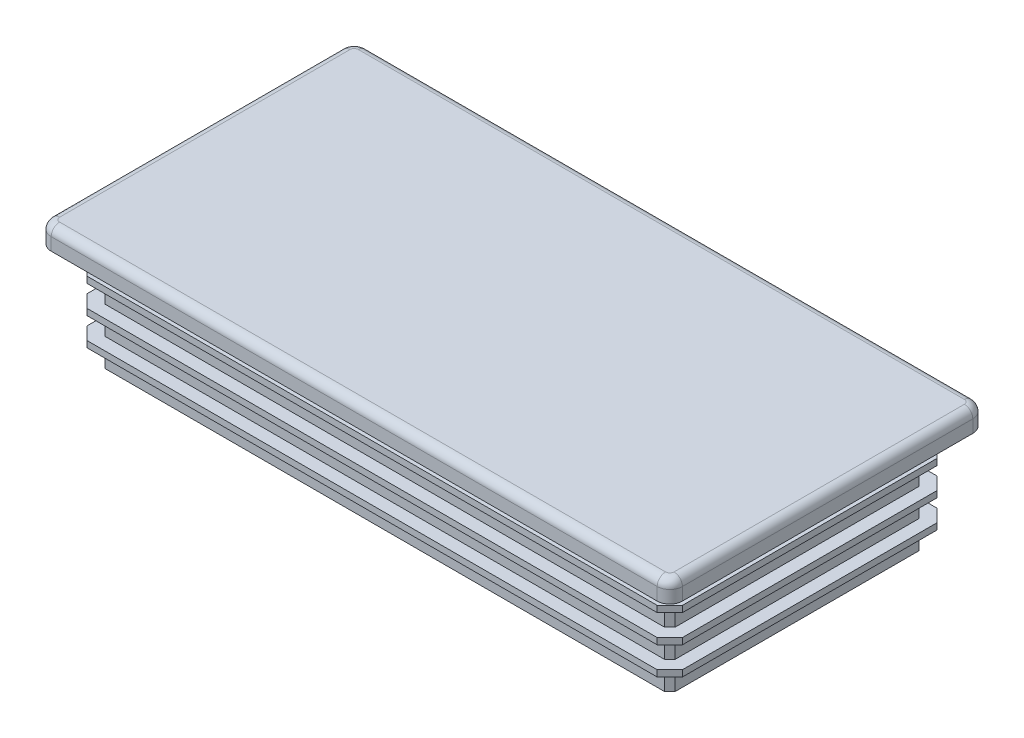
from build123d import *

# Parameters (mm, degrees)
SKETCH1_W           = 71.882
SKETCH1_H           = 33.782
BOSS_EXTRUDE1_DEPTH = 12.7
BOSS_EXTRUDE2_DEPTH = 2.54
CHAMFER1_SIZE       = 1.524
SHELL1_T            = -2.54
SKETCH4_W           = 1.524
SKETCH4_H           = 2.6035
FILLET2_R           = 1.016


with BuildPart() as part:
    # Sketch1 → Boss-Extrude1 (new body)
    with BuildSketch(Plane(origin=(0, 0, 0), x_dir=(1, 0, 0), z_dir=(0, 1, 0))):
        Rectangle(SKETCH1_W, SKETCH1_H)
    extrude(amount=BOSS_EXTRUDE1_DEPTH)

    # Sketch2 → Boss-Extrude2 (add)
    with BuildSketch(Plane(origin=(0, 12.7, 0), x_dir=(1, 0, 0), z_dir=(0, 1, 0))):
        with BuildLine():
            Line((-38.1, 17.526), (-38.1, -17.526))
            ThreePointArc((-38.1, -17.526), (-37.653630735, -18.603630735), (-36.576, -19.05))
            Line((-36.576, -19.05), (36.576, -19.05))
            ThreePointArc((36.576, -19.05), (37.653630735, -18.603630735), (38.1, -17.526))
            Line((38.1, -17.526), (38.1, 17.526))
            ThreePointArc((38.1, 17.526), (37.653630735, 18.603630735), (36.576, 19.05))
            Line((36.576, 19.05), (-36.576, 19.05))
            ThreePointArc((-36.576, 19.05), (-37.653630735, 18.603630735), (-38.1, 17.526))
        make_face()
    extrude(amount=BOSS_EXTRUDE2_DEPTH)

    # Chamfer1
    chamfer1_edges = [part.edges().sort_by_distance(p)[0] for p in [
        (35.941, 6.35, 16.891),
        (-35.941, 6.35, 16.891),
        (-35.941, 6.35, -16.891),
        (35.941, 6.35, -16.891),
    ]]
    chamfer(chamfer1_edges, length=CHAMFER1_SIZE)

    # Shell1
    shell1_openings = [part.faces().sort_by_distance(p)[0] for p in [
        (0, 0, 0),
    ]]
    offset(amount=SHELL1_T, openings=shell1_openings, kind=Kind.INTERSECTION)

    # Cut-Sweep2: sweep along a path in Sketch3
    with BuildLine(Plane(origin=(0, 0, 0), x_dir=(-1, 0, 0), z_dir=(0, -1, 0))) as cut_sweep2_path:
        Line((-35.941, 15.367), (-35.941, -15.367))
        Line((-35.941, -15.367), (-34.417, -16.891))
        Line((-34.417, -16.891), (34.417, -16.891))
        Line((34.417, -16.891), (35.941, -15.367))
        Line((35.941, -15.367), (35.941, 15.367))
        Line((35.941, 15.367), (34.417, 16.891))
        Line((34.417, 16.891), (-34.417, 16.891))
        Line((-34.417, 16.891), (-35.941, 15.367))
    # Sketch4 → Cut-Sweep2 (sweep, cut)
    with BuildSketch(Plane.XY):
        with Locations((35.179, 1.30175)):
            Rectangle(SKETCH4_W, SKETCH4_H)
        with Locations((35.179, 8.03275)):
            Rectangle(SKETCH4_W, SKETCH4_H)
        with Locations((35.179, 11.39825)):
            Rectangle(SKETCH4_W, SKETCH4_H)
        with Locations((35.179, 4.66725)):
            Rectangle(SKETCH4_W, SKETCH4_H)
    sweep(path=cut_sweep2_path.line, transition=Transition.RIGHT, mode=Mode.SUBTRACT)

    # Fillet2
    fillet2_edges = [part.edges().sort_by_distance(p)[0] for p in [
        (-37.653630735, 15.24, 18.603630735),
        (0, 15.24, 19.05),
        (37.653630735, 15.24, 18.603630735),
        (38.1, 15.24, 0),
        (37.653630735, 15.24, -18.603630735),
        (0, 15.24, -19.05),
        (-37.653630735, 15.24, -18.603630735),
        (-38.1, 15.24, 0),
    ]]
    fillet(fillet2_edges, radius=FILLET2_R)


solid = part.part
